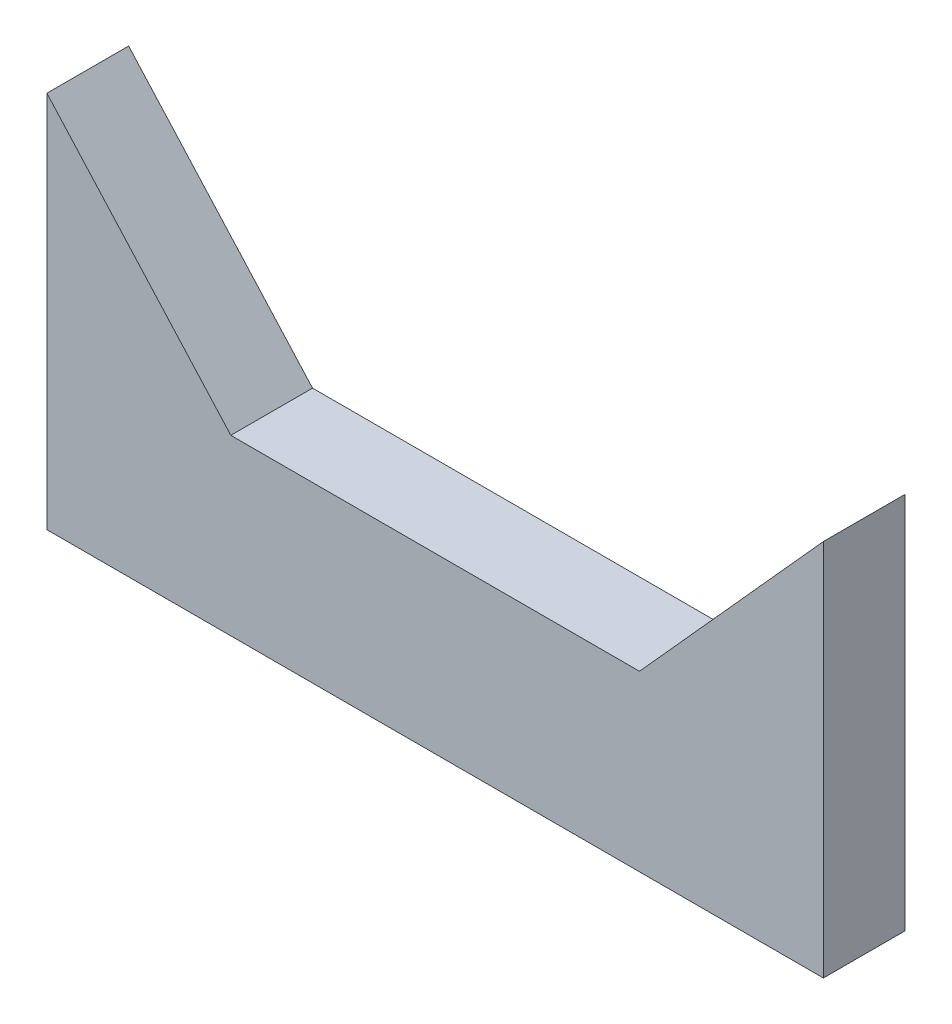
from build123d import *

# Parameters (mm, degrees)
BOSS_EXTRUDE1_DEPTH = 4


with BuildPart() as part:
    # Sketch1 → Boss-Extrude1 (new body)
    with BuildSketch(Plane.XY):
        Polygon((19, 8.304302294), (19, -10.195697706), (-19, -10.195697706), (-19, 8.304302294), (-10, -1.695697706), (10, -1.695697706), align=None)
    extrude(amount=BOSS_EXTRUDE1_DEPTH)


solid = part.part
